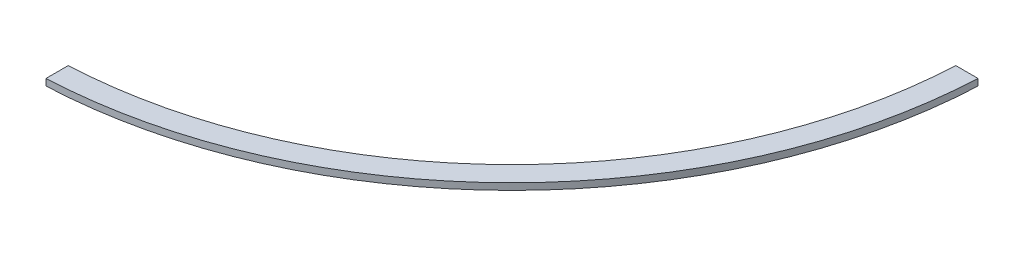
from build123d import *

# Parameters (mm, degrees)
SKETCH1_R            = 220
SKETCH1_R_2          = 210
BOSS_EXTRUDE1_DEPTH  = 1.5
QUADRUPLE_DEPTH      = 312.130599588
QUADRUPLE_DEPTH_BACK = 312.130599588
SKETCH2_W            = 20
SKETCH2_H            = 440
SKETCH2_W_2          = 440
SKETCH2_H_2          = 20
SKETCH4_W            = 439.545219516
SKETCH4_H            = 3
HALF_DEPTH           = 311.809024965
SKETCH5_W            = 439.545219516
SKETCH5_H            = 3
QUARTER_DEPTH        = 311.809024965


with BuildPart() as part:
    # Sketch1 → Boss-Extrude1 (new, symmetric)
    with BuildSketch(Plane(origin=(0, 0, 0), x_dir=(1, 0, 0), z_dir=(0, 1, 0))):
        with Locations(Location((0, 0, 0), (0, 0, 270))):
            Circle(SKETCH1_R)
        with Locations(Location((0, 0, 0), (0, 0, 270))):
            Circle(SKETCH1_R_2, mode=Mode.SUBTRACT)
    extrude(amount=BOSS_EXTRUDE1_DEPTH, both=True)

    # Sketch2 → quadruple (cut, two sides: drawn at the far end of the back side and taken through both)
    with BuildSketch(Plane(origin=(0, 0, 0), x_dir=(1, 0, 0), z_dir=(0, 1, 0)).offset(-QUADRUPLE_DEPTH_BACK)):
        Rectangle(SKETCH2_W, SKETCH2_H)
        Rectangle(SKETCH2_W_2, SKETCH2_H_2)
    extrude(amount=QUADRUPLE_DEPTH + QUADRUPLE_DEPTH_BACK, mode=Mode.SUBTRACT)


with BuildPart() as quadruple_piece_1:
    # of the separate pieces the step leaves, piece 1, a body of its own (quadruple_pieces)
    add(part.part.solids().sort_by_distance((-219.772609758, -1.5, 10))[0])

    # Sketch5 → quarter (cut, through all)
    with BuildSketch(Plane(origin=(0, 0, 0), x_dir=(0, 0, -1), z_dir=(1, 0, 0))):
        Rectangle(SKETCH5_W, SKETCH5_H)
    extrude(amount=-QUARTER_DEPTH, mode=Mode.SUBTRACT)


with BuildPart() as quadruple_piece_2:
    # of the separate pieces the step leaves, piece 2, a body of its own (quadruple_pieces)
    add(part.part.solids().sort_by_distance((-10, 1.5, -219.772609758))[0])


with BuildPart() as quadruple_piece_3:
    # of the separate pieces the step leaves, piece 3, a body of its own (quadruple_pieces)
    add(part.part.solids().sort_by_distance((10, -1.5, 219.772609758))[0])


with BuildPart() as quadruple_piece_4:
    # of the separate pieces the step leaves, piece 4, a body of its own (quadruple_pieces)
    add(part.part.solids().sort_by_distance((209.761769634, 1.5, -10))[0])


with BuildPart() as half_tool:
    # Sketch4 → half (new, through all)
    with BuildSketch(Plane.XY):
        Rectangle(SKETCH4_W, SKETCH4_H)
    extrude(amount=-HALF_DEPTH)


with BuildPart() as quadruple_piece_2_1:
    add(quadruple_piece_2.part)

    # half: cut by half_tool
    add(half_tool.part, mode=Mode.SUBTRACT)


with BuildPart() as quadruple_piece_4_1:
    add(quadruple_piece_4.part)

    # half: cut by half_tool
    add(half_tool.part, mode=Mode.SUBTRACT)


solid = quadruple_piece_3.part
